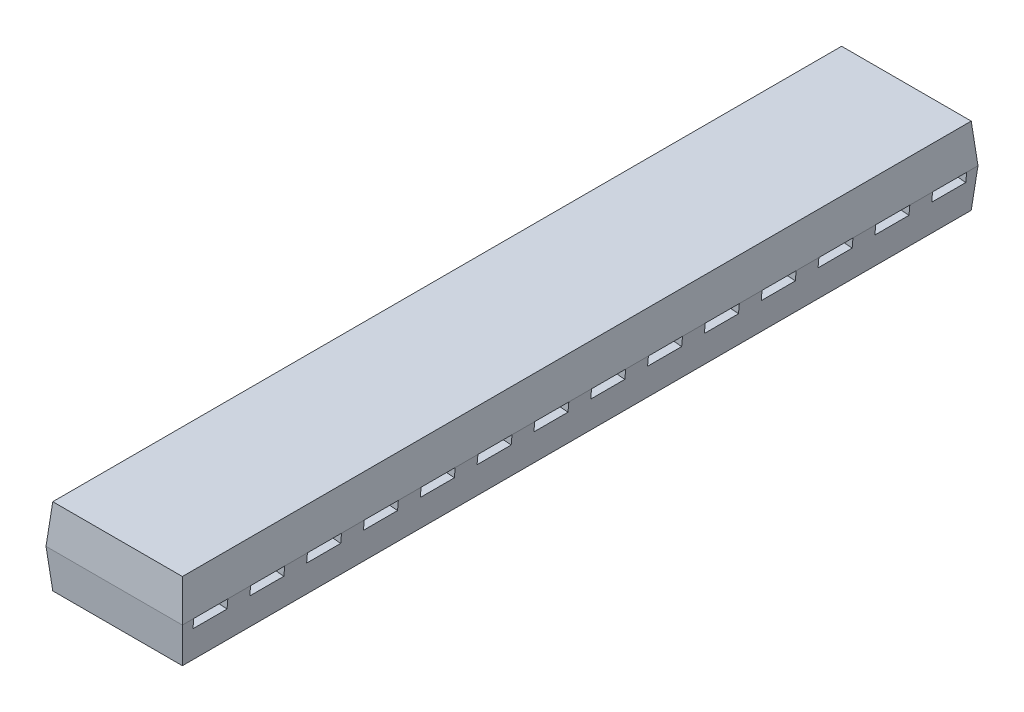
from build123d import *

# Parameters (mm, degrees)
SKETCH1_W                     = 6
SKETCH1_H                     = 35
BOSS_EXTRUDE1_DEPTH           = 1.7
BOSS_EXTRUDE1_TAPER           = 5
BOSS_EXTRUDE1_OTHER_WAY_DEPTH = 1.7
BOSS_EXTRUDE1_OTHER_WAY_TAPER = 5
SKETCH2_W                     = 1.5
SKETCH2_H                     = 0.41
CUT_EXTRUDE1_DEPTH            = 1.7


with BuildPart() as part:
    # Sketch1 → Boss-Extrude1 (new body)
    with BuildSketch(Plane(origin=(0, 0, 0), x_dir=(1, 0, 0), z_dir=(0, 1, 0))):
        with Locations((3, 17.5)):
            Rectangle(SKETCH1_W, SKETCH1_H)
    extrude(amount=BOSS_EXTRUDE1_DEPTH, taper=BOSS_EXTRUDE1_TAPER)

    # Sketch1 → Boss-Extrude1 other way (add)
    with BuildSketch(Plane(origin=(0, 0, 0), x_dir=(1, 0, 0), z_dir=(0, 1, 0))):
        with Locations((3, 17.5)):
            Rectangle(SKETCH1_W, SKETCH1_H)
    extrude(amount=-BOSS_EXTRUDE1_OTHER_WAY_DEPTH, taper=BOSS_EXTRUDE1_OTHER_WAY_TAPER)

    # Sketch2 → Cut-Extrude1 (cut)
    with BuildSketch(Plane(origin=(5.954423259, -0.520944533, 0), x_dir=(0, 0, -1), z_dir=(0.9961946980917457, -0.08715574274765837, 0))):
        with Locations((1.25, 0.317934456)):
            Rectangle(SKETCH2_W, SKETCH2_H)
        with Locations((3.75, 0.317934456)):
            Rectangle(SKETCH2_W, SKETCH2_H)
        with Locations((6.25, 0.317934456)):
            Rectangle(SKETCH2_W, SKETCH2_H)
        with Locations((8.75, 0.317934456)):
            Rectangle(SKETCH2_W, SKETCH2_H)
        with Locations((11.25, 0.317934456)):
            Rectangle(SKETCH2_W, SKETCH2_H)
        with Locations((13.75, 0.317934456)):
            Rectangle(SKETCH2_W, SKETCH2_H)
        with Locations((16.25, 0.317934456)):
            Rectangle(SKETCH2_W, SKETCH2_H)
        with Locations((18.75, 0.317934456)):
            Rectangle(SKETCH2_W, SKETCH2_H)
        with Locations((21.25, 0.317934456)):
            Rectangle(SKETCH2_W, SKETCH2_H)
        with Locations((23.75, 0.317934456)):
            Rectangle(SKETCH2_W, SKETCH2_H)
        with Locations((26.25, 0.317934456)):
            Rectangle(SKETCH2_W, SKETCH2_H)
        with Locations((28.75, 0.317934456)):
            Rectangle(SKETCH2_W, SKETCH2_H)
        with Locations((31.25, 0.317934456)):
            Rectangle(SKETCH2_W, SKETCH2_H)
        with Locations((33.75, 0.317934456)):
            Rectangle(SKETCH2_W, SKETCH2_H)
    cut_extrude1 = extrude(amount=-CUT_EXTRUDE1_DEPTH, mode=Mode.SUBTRACT)

    # Mirror1: Cut-Extrude1 across plane
    add(cut_extrude1.mirror(Plane(origin=(3, 0, 0), x_dir=(0, 0, 1), z_dir=(1, 0, 0))), mode=Mode.SUBTRACT)


solid = part.part
